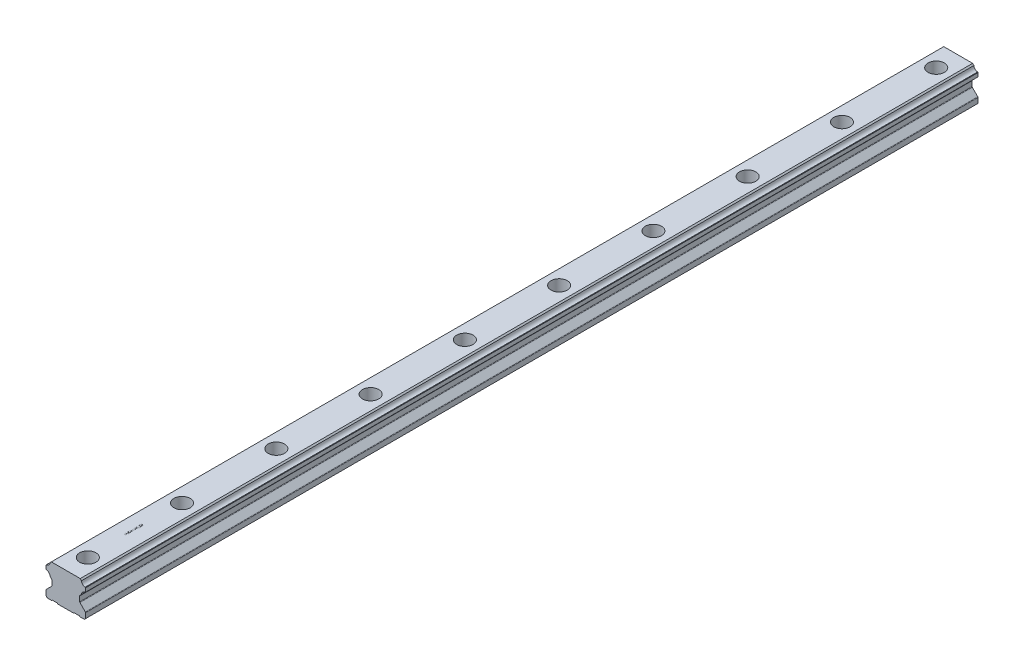
from build123d import *

# Parameters (mm, degrees)
EXTRUDE_1_DEPTH               = 1420
HOLE_WIZARD_M16_1_D           = 18
HOLE_WIZARD_M16_1_CBORE_D     = 26
HOLE_WIZARD_M16_1_CBORE_DEPTH = 22
PATTERN_LINEAR_1_COUNT        = 10
PATTERN_LINEAR_1_PITCH        = 150
SKETCH_6_W                    = 3.5
SKETCH_6_H                    = 0.314102564
CUT_EXTRUDE_1_DEPTH           = 0.1


with BuildPart() as part:
    # 草图1 → 凸台-拉伸1 (new body)
    with BuildSketch(Plane.XY):
        with BuildLine():
            Line((-23.000030581, 53), (-24.991126345, 51.008904236))
            ThreePointArc((-24.991126345, 51.008904236), (-26.747381462, 46.881368462), (-30.874917236, 45.125113345))
            Line((-30.874917236, 45.125113345), (-31.5, 44.500030581))
            Line((-31.5, 44.500030581), (-31.5, 38.499998))
            Line((-31.5, 38.499998), (-30.87588311, 37.87588111))
            ThreePointArc((-30.87588311, 37.87588111), (-26.747381462, 36.119607538), (-24.99110789, 31.99110589))
            Line((-24.99110789, 31.99110589), (-22.539339828, 29.539337828))
            ThreePointArc((-22.539339828, 29.539337828), (-22.214180701, 29.052702805), (-22.1, 28.478677656))
            Line((-22.1, 28.478677656), (-22.1, 20.6627417))
            ThreePointArc((-22.1, 20.6627417), (-22.214180701, 20.088716551), (-22.539339828, 19.602081528))
            Line((-22.539339828, 19.602081528), (-31.060660172, 11.080761184))
            ThreePointArc((-31.060660172, 11.080761184), (-31.385819299, 10.594126161), (-31.5, 10.020101013))
            Line((-31.5, 10.020101013), (-31.5, 2))
            Line((-31.5, 2), (-29.5, 0))
            Line((-29.5, 0), (-22.5, 0))
            Line((-22.5, 0), (-21.500011002, 1))
            Line((-21.500011002, 1), (-13.500001416, 1))
            Line((-13.500001416, 1), (-12.5, 0))
            Line((-12.5, 0), (12.5, 0))
            Line((12.5, 0), (13.500001416, 1))
            Line((13.500001416, 1), (21.500011002, 1))
            Line((21.500011002, 1), (22.5, 0))
            Line((22.5, 0), (29.5, 0))
            Line((29.5, 0), (31.5, 2))
            Line((31.5, 2), (31.5, 10.020101013))
            ThreePointArc((31.5, 10.020101013), (31.385819299, 10.594126161), (31.060660172, 11.080761184))
            Line((31.060660172, 11.080761184), (22.539339828, 19.602081528))
            ThreePointArc((22.539339828, 19.602081528), (22.214180701, 20.088716551), (22.1, 20.6627417))
            Line((22.1, 20.6627417), (22.1, 28.478677656))
            ThreePointArc((22.1, 28.478677656), (22.214180701, 29.052702805), (22.539339828, 29.539337828))
            Line((22.539339828, 29.539337828), (24.99110789, 31.99110589))
            ThreePointArc((24.99110789, 31.99110589), (26.747381462, 36.119607538), (30.87588311, 37.87588111))
            Line((30.87588311, 37.87588111), (31.5, 38.499998))
            Line((31.5, 38.499998), (31.5, 44.500030581))
            Line((31.5, 44.500030581), (30.874917236, 45.125113345))
            ThreePointArc((30.874917236, 45.125113345), (26.747381462, 46.881368462), (24.991126345, 51.008904236))
            Line((24.991126345, 51.008904236), (23.000030581, 53))
            Line((23.000030581, 53), (-23.000030581, 53))
        make_face()
    extrude(amount=-EXTRUDE_1_DEPTH)

    # M16 六角凹头螺钉的柱形沉头孔1 (through all)
    with Locations(Plane(origin=(-6.823926913, 53, -130.778829662), x_dir=(-1, 0, 0), z_dir=(0, 1, 0))):
        with Locations((-6.823926913, 95.778829662)):
            hole_wizard_m16_1 = CounterBoreHole(HOLE_WIZARD_M16_1_D / 2, HOLE_WIZARD_M16_1_CBORE_D / 2, HOLE_WIZARD_M16_1_CBORE_DEPTH)

    # 阵列(线性)1: M16 六角凹头螺钉的柱形沉头孔1 ×10
    with Locations(*[(0, 0, -i * PATTERN_LINEAR_1_PITCH) for i in range(1, PATTERN_LINEAR_1_COUNT)]):
        add(hole_wizard_m16_1, mode=Mode.SUBTRACT)

    # 草图6 → 切除-拉伸1 (cut)
    # profile 1 of 9: a face of its own
    with BuildSketch(Plane(origin=(0, 53, 0), x_dir=(1, 0, 0), z_dir=(0, 1, 0))):
        Polygon((-3.5, 96.403846154), (-3.5, 96.717948718), (-2.064102564, 96.717948718), (-2.064102564, 98.512820513), (-3.5, 98.512820513), (-3.5, 98.826923077), (0, 98.826923077), (0, 98.512820513), (-1.705128205, 98.512820513), (-1.705128205, 96.717948718), (0, 96.717948718), (0, 96.403846154), align=None)
    # profile 2 of 9: a face of its own
    with BuildSketch(Plane(origin=(0, 53, 0), x_dir=(1, 0, 0), z_dir=(0, 1, 0))):
        with Locations((-1.75, 99.881410256)):
            Rectangle(SKETCH_6_W, SKETCH_6_H)
    # profile 3 of 9: a face of its own
    with BuildSketch(Plane(origin=(0, 53, 0), x_dir=(1, 0, 0), z_dir=(0, 1, 0))):
        Polygon((-3.5, 100.576923077), (-3.5, 100.901542468), (-0.933193109, 101.586538462), (-3.5, 102.605268429), (-3.5, 102.650841346), (-0.950721154, 103.650641026), (-3.5, 104.339142628), (-3.5, 104.66025641), (0, 103.716546474), (0, 103.671674679), (-2.676883013, 102.618589744), (0, 101.552884615), (0, 101.508012821), align=None)
    # profile 4 of 9: a face of its own
    with BuildSketch(Plane(origin=(0, 53, 0), x_dir=(1, 0, 0), z_dir=(0, 1, 0))):
        with Locations((-1.75, 105.625)):
            Rectangle(SKETCH_6_W, SKETCH_6_H)
    # profile 5 of 9: a face of its own
    with BuildSketch(Plane(origin=(0, 53, 0), x_dir=(1, 0, 0), z_dir=(0, 1, 0))):
        Polygon((0, 106.544871795), (-3.5, 106.544871795), (-3.5, 106.610777244), (-0.745292468, 108.923076923), (-3.5, 108.923076923), (-3.5, 109.237179487), (0, 109.237179487), (0, 109.165665064), (-2.748397436, 106.858974359), (0, 106.858974359), align=None)
    # profile 6 of 9: a face of its own
    with BuildSketch(Plane(origin=(0, 53, 0), x_dir=(1, 0, 0), z_dir=(0, 1, 0))):
        Polygon((-3.5, 111.480769231), (-3.5, 111.794871795), (-2.064102564, 111.794871795), (-2.064102564, 113.58974359), (-3.5, 113.58974359), (-3.5, 113.903846154), (0, 113.903846154), (0, 113.58974359), (-1.705128205, 113.58974359), (-1.705128205, 111.794871795), (0, 111.794871795), (0, 111.480769231), align=None)
    # profile 7 of 9: a face of its own
    with BuildSketch(Plane(origin=(0, 53, 0), x_dir=(1, 0, 0), z_dir=(0, 1, 0))):
        with BuildLine():
            Line((-2.902644231, 118.076923077), (-2.647435897, 117.807692308))
            add(Edge.make_bspline(
                [(-2.647435897, 117.807692308), (-2.69328212, 117.758983227), (-2.783881335, 117.662726562), (-2.901244074, 117.50552662), (-3.002777003, 117.342170767), (-3.084772592, 117.172394867), (-3.149094254, 117.000650867), (-3.195850217, 116.829891913), (-3.225460377, 116.661223615), (-3.229016796, 116.549059313), (-3.230769231, 116.493790064)],
                knots=[0, 0, 0, 0, 1.089067066, 2.152164705, 3.18986567, 4.218445106, 5.218487318, 6.173592265, 7.100032889, 8, 8, 8, 8], degree=3))
            add(Edge.make_bspline(
                [(-3.230769231, 116.493790064), (-3.230355625, 116.459875364), (-3.229529486, 116.392133924), (-3.218985271, 116.29151198), (-3.203820407, 116.191945342), (-3.181878529, 116.093621968), (-3.15406947, 115.99635068), (-3.119284004, 115.900469793), (-3.078728771, 115.805800421), (-3.031866252, 115.713234402), (-2.980386575, 115.623493669), (-2.923337414, 115.538737672), (-2.862550889, 115.458421211), (-2.796491613, 115.384072004), (-2.725807311, 115.31519549), (-2.651770944, 115.250524789), (-2.572926872, 115.191265211), (-2.489599321, 115.138479571), (-2.403726867, 115.090811977), (-2.316037795, 115.049619777), (-2.227346143, 115.013809823), (-2.136984078, 114.986535862), (-2.045883197, 114.963434988), (-1.953566086, 114.947353752), (-1.859791669, 114.938257435), (-1.796993971, 114.936686944), (-1.765424679, 114.935897436)],
                knots=[0, 0, 0, 0, 1.028150113, 2.053633673, 3.06513288, 4.081487945, 5.106702018, 6.131327874, 7.172780699, 8.228344599, 9.276313556, 10.308389736, 11.324843658, 12.329040066, 13.321460474, 14.316307835, 15.308626991, 16.309440696, 17.305625405, 18.28535951, 19.246194545, 20.203493668, 21.145557131, 22.095268976, 23.042464743, 24, 24, 24, 24], degree=3))
            add(Edge.make_bspline(
                [(-1.765424679, 114.935897436), (-1.733154018, 114.936653631), (-1.668700816, 114.938163957), (-1.572504414, 114.947817154), (-1.477747832, 114.965772364), (-1.384282029, 114.989584114), (-1.291920993, 115.019856789), (-1.20076111, 115.057049303), (-1.110811241, 115.101355435), (-1.022964324, 115.152526704), (-0.937464192, 115.209036172), (-0.856251713, 115.271187356), (-0.780271995, 115.339084893), (-0.708415252, 115.411483836), (-0.641134974, 115.489043832), (-0.579242122, 115.572517364), (-0.521779643, 115.660735956), (-0.469378807, 115.753738745), (-0.42257144, 115.850542725), (-0.38094723, 115.949799156), (-0.346667976, 116.051827058), (-0.31872985, 116.156089724), (-0.295829559, 116.262463002), (-0.281097077, 116.371486803), (-0.270406246, 116.482359512), (-0.269624576, 116.557098144), (-0.269230769, 116.594751603)],
                knots=[0, 0, 0, 0, 0.935915162, 1.869274651, 2.799799983, 3.730201895, 4.664668062, 5.616159355, 6.583070886, 7.570012957, 8.562524459, 9.553461134, 10.53281078, 11.515274572, 12.509912756, 13.507571325, 14.526460018, 15.561318395, 16.601025881, 17.643204557, 18.680545676, 19.719612342, 20.772381578, 21.833430283, 22.908478249, 24, 24, 24, 24], degree=3))
            add(Edge.make_bspline(
                [(-0.269230769, 116.594751603), (-0.270178952, 116.640130135), (-0.272040863, 116.729238255), (-0.286546735, 116.860222075), (-0.309173205, 116.986034693), (-0.342412256, 117.106266531), (-0.384484705, 117.221353926), (-0.436513285, 117.330872414), (-0.497950569, 117.435124408), (-0.567552463, 117.533658668), (-0.645100929, 117.624132689), (-0.728035637, 117.706474768), (-0.817431068, 117.77785339), (-0.911954918, 117.840400707), (-1.012511326, 117.892097951), (-1.118540888, 117.934543829), (-1.230109213, 117.967076285), (-1.307200733, 117.980431374), (-1.346153846, 117.987179487)],
                knots=[0, 0, 0, 0, 1.130199668, 2.219330667, 3.279027493, 4.311506524, 5.322739849, 6.327972234, 7.327472899, 8.33386792, 9.329086447, 10.29244429, 11.240784345, 12.174119183, 13.111530729, 14.052100829, 15.015757696, 16, 16, 16, 16], degree=3))
            Line((-1.346153846, 117.987179487), (-1.346153846, 116.820512821))
            Line((-1.346153846, 116.820512821), (-1.705128205, 116.820512821))
            Line((-1.705128205, 116.820512821), (-1.705128205, 118.301282051))
            add(Edge.make_bspline(
                [(-1.705128205, 118.301282051), (-1.638220716, 118.299576203), (-1.507270675, 118.296237549), (-1.316300404, 118.272818634), (-1.13592871, 118.235002122), (-0.965965639, 118.18334181), (-0.806652046, 118.116466529), (-0.65782618, 118.035094001), (-0.520449499, 117.93792188), (-0.393400495, 117.828411438), (-0.280071283, 117.705511481), (-0.180465345, 117.572542861), (-0.09656273, 117.429285892), (-0.028302067, 117.275876085), (0.024971927, 117.112815651), (0.062743504, 116.939727272), (0.085373467, 116.756845671), (0.088264847, 116.631508994), (0.08974359, 116.567407853)],
                knots=[0, 0, 0, 0, 1.140356446, 2.231883559, 3.274166699, 4.278491846, 5.25512956, 6.21435461, 7.1637429, 8.11826594, 9.068280886, 10.0076534, 10.945064095, 11.891975133, 12.864533718, 13.863980011, 14.907571808, 16, 16, 16, 16], degree=3))
            add(Edge.make_bspline(
                [(0.08974359, 116.567407853), (0.089174469, 116.527897717), (0.088051978, 116.449970996), (0.080074631, 116.334880068), (0.067794054, 116.222962448), (0.049248931, 116.114234439), (0.026534277, 116.008296097), (-0.002552442, 115.905676512), (-0.036221141, 115.80598477), (-0.074516815, 115.709066784), (-0.118888472, 115.615802237), (-0.168198111, 115.52577572), (-0.222191472, 115.438489595), (-0.281802318, 115.35453843), (-0.346584778, 115.273484808), (-0.416668697, 115.195851364), (-0.491839816, 115.121203486), (-0.545218826, 115.074443023), (-0.572115385, 115.05088141)],
                knots=[0, 0, 0, 0, 1.107784379, 2.184907829, 3.233506516, 4.263428166, 5.276301166, 6.270063455, 7.25232949, 8.225834625, 9.190232166, 10.146266622, 11.1027726, 12.066435141, 13.031522626, 14.010570082, 14.99756817, 16, 16, 16, 16], degree=3))
            add(Edge.make_bspline(
                [(-0.572115385, 115.05088141), (-0.614786038, 115.016695478), (-0.699419055, 114.948891066), (-0.835018999, 114.861612909), (-0.975420859, 114.787211506), (-1.121015488, 114.726843684), (-1.271666701, 114.679705598), (-1.427181992, 114.645899345), (-1.587761622, 114.626092056), (-1.696426887, 114.623238518), (-1.751402244, 114.621794872)],
                knots=[0, 0, 0, 0, 1.023165419, 2.029347347, 3.013907458, 3.994755782, 4.975994455, 5.96558838, 6.970761222, 8, 8, 8, 8], degree=3))
            add(Edge.make_bspline(
                [(-1.751402244, 114.621794872), (-1.792568496, 114.62232711), (-1.874377804, 114.623384821), (-1.99583511, 114.636210339), (-2.115135808, 114.654611751), (-2.232182344, 114.681658827), (-2.347053012, 114.715755013), (-2.45980069, 114.758308794), (-2.570493643, 114.807852572), (-2.67836343, 114.865442289), (-2.782003044, 114.929511026), (-2.880905313, 114.999118682), (-2.973467332, 115.074802367), (-3.059903521, 115.156782462), (-3.141494975, 115.243406392), (-3.216537375, 115.336492693), (-3.286205011, 115.434631029), (-3.349159221, 115.538582169), (-3.405727075, 115.6467058), (-3.455315154, 115.758766886), (-3.496298775, 115.874724704), (-3.531072472, 115.993712261), (-3.556787635, 116.11662974), (-3.575436374, 116.242585283), (-3.588196976, 116.372235393), (-3.589223231, 116.459871423), (-3.58974359, 116.504306891)],
                knots=[0, 0, 0, 0, 1.00895651, 2.005089799, 2.991467152, 3.967318338, 4.948153826, 5.927364234, 6.919980553, 7.91976625, 8.923240147, 9.905815003, 10.88314567, 11.851989312, 12.825009789, 13.798721852, 14.781296708, 15.773896486, 16.776076962, 17.771600213, 18.775744723, 19.78957137, 20.808953803, 21.851964491, 22.910847925, 24, 24, 24, 24], degree=3))
            add(Edge.make_bspline(
                [(-3.58974359, 116.504306891), (-3.589164098, 116.540545135), (-3.588015034, 116.612401313), (-3.580050386, 116.719327046), (-3.567426505, 116.82460006), (-3.550199718, 116.92837645), (-3.526736028, 117.030302816), (-3.498657743, 117.130669522), (-3.46596592, 117.229622058), (-3.426977074, 117.326850307), (-3.382723449, 117.423008023), (-3.332910027, 117.518629864), (-3.276685022, 117.61338911), (-3.213881487, 117.707450091), (-3.145578069, 117.801405949), (-3.069821245, 117.893770591), (-2.989598489, 117.986773536), (-2.931916305, 118.04657535), (-2.902644231, 118.076923077)],
                knots=[0, 0, 0, 0, 0.985871117, 1.954866573, 2.915460327, 3.869826059, 4.81536089, 5.759505086, 6.70452669, 7.649098992, 8.607881297, 9.583363685, 10.581137262, 11.603961102, 12.659522466, 13.73993555, 14.853081303, 16, 16, 16, 16], degree=3))
        make_face()
    # profile 8 of 9: a face of its own
    with BuildSketch(Plane(origin=(0, 53, 0), x_dir=(1, 0, 0), z_dir=(0, 1, 0))):
        with BuildLine():
            Line((-3.58974359, 120.320512821), (-3.399739583, 120.56239984))
            Line((-3.399739583, 120.56239984), (-1.985576923, 119.637620192))
            add(Edge.make_bspline(
                [(-1.985576923, 119.637620192), (-1.995390784, 119.699190469), (-2.014533829, 119.819290256), (-2.017691774, 119.940856155), (-2.019230769, 120.00010016)],
                knots=[0, 0, 0, 0, 1.025318673, 2, 2, 2, 2], degree=3))
            add(Edge.make_bspline(
                [(-2.019230769, 120.00010016), (-2.018274658, 120.035672657), (-2.01639258, 120.105696057), (-2.001908729, 120.208502858), (-1.979083619, 120.307291798), (-1.945811357, 120.401653396), (-1.903309025, 120.49192643), (-1.852370067, 120.578628629), (-1.790364723, 120.660131396), (-1.721098473, 120.737479659), (-1.644386305, 120.807717612), (-1.56296755, 120.869854406), (-1.476848647, 120.922334119), (-1.386048964, 120.964144997), (-1.291279266, 120.997559294), (-1.192169945, 121.021346206), (-1.088553728, 121.03556638), (-1.018073453, 121.037486285), (-0.982271635, 121.038461538)],
                knots=[0, 0, 0, 0, 1.043709831, 2.054511743, 3.041122595, 4.01515914, 4.98481438, 5.965901842, 6.960491961, 7.985277438, 9.0096037, 10.00832444, 10.987059228, 11.962929573, 12.936966118, 13.931840027, 14.949438142, 16, 16, 16, 16], degree=3))
            add(Edge.make_bspline(
                [(-0.982271635, 121.038461538), (-0.933290098, 121.037041892), (-0.836906025, 121.034248364), (-0.696555504, 121.006295162), (-0.562926162, 120.96318285), (-0.438330275, 120.900574384), (-0.321904881, 120.824281584), (-0.219084187, 120.730100517), (-0.127384518, 120.622703924), (-0.050736149, 120.501204069), (0.011869141, 120.370464648), (0.056833789, 120.23311171), (0.084517414, 120.090484811), (0.087987996, 119.99368017), (0.08974359, 119.944711538)],
                knots=[0, 0, 0, 0, 1.031403119, 2.029557249, 3.004870281, 3.983165322, 4.960181699, 5.929903783, 6.912123683, 7.928973898, 8.949315281, 9.960468141, 10.968302741, 12, 12, 12, 12], degree=3))
            add(Edge.make_bspline(
                [(0.08974359, 119.944711538), (0.088219727, 119.897612856), (0.085201221, 119.804318611), (0.058171766, 119.667114809), (0.014673233, 119.535045219), (-0.046510348, 119.409805139), (-0.122487554, 119.293596564), (-0.213316504, 119.188799795), (-0.319123382, 119.098223467), (-0.437593599, 119.022166614), (-0.564720568, 118.961587346), (-0.69750636, 118.916582541), (-0.835393511, 118.890155545), (-0.928876381, 118.886471136), (-0.975961538, 118.884615385)],
                knots=[0, 0, 0, 0, 1.012172929, 2.004937354, 2.995255351, 3.995689452, 4.993936421, 5.973737378, 6.968231049, 7.979117505, 8.993136101, 9.989812463, 10.987515067, 12, 12, 12, 12], degree=3))
            add(Edge.make_bspline(
                [(-0.975961538, 118.884615385), (-1.012006122, 118.88579683), (-1.085602274, 118.888209115), (-1.197066302, 118.905052505), (-1.311117383, 118.9321173), (-1.407871577, 118.962427546), (-1.487133099, 118.994453156), (-1.55103659, 119.021105696), (-1.616797663, 119.054279692), (-1.686671299, 119.089653073), (-1.758856731, 119.130409942), (-1.834560401, 119.174725591), (-1.912578329, 119.223825242), (-1.965522524, 119.258245405), (-1.992588141, 119.275841346)],
                knots=[0, 0, 0, 0, 1.173818275, 2.396712641, 3.66331629, 4.989737886, 5.693666774, 6.447286557, 7.243889047, 8.091586357, 8.998013824, 9.943181721, 10.948533338, 12, 12, 12, 12], degree=3))
            Line((-1.992588141, 119.275841346), (-3.58974359, 120.320512821))
        make_face()
        with BuildLine():
            add(Edge.make_bspline(
                [(-1.66025641, 119.934194712), (-1.659485878, 119.907529869), (-1.657980805, 119.855445686), (-1.649050486, 119.779074605), (-1.632796287, 119.70655985), (-1.610258424, 119.637880373), (-1.582471876, 119.572612494), (-1.546819296, 119.51204964), (-1.505292177, 119.454945565), (-1.457965644, 119.402212643), (-1.406184395, 119.354390165), (-1.350713106, 119.313209767), (-1.292899361, 119.277687177), (-1.232257298, 119.248805409), (-1.168810831, 119.226315319), (-1.102851573, 119.210047072), (-1.033937269, 119.20099332), (-0.987204766, 119.199487089), (-0.963341346, 119.198717949)],
                knots=[0, 0, 0, 0, 1.129656352, 2.206547016, 3.251334079, 4.271920891, 5.265058649, 6.249872215, 7.241923875, 8.251504132, 9.246416584, 10.222533834, 11.173322129, 12.116503788, 13.062124155, 14.020151864, 14.989013135, 16, 16, 16, 16], degree=3))
            add(Edge.make_bspline(
                [(-0.963341346, 119.198717949), (-0.939695498, 119.199366491), (-0.893098454, 119.200644523), (-0.824698752, 119.211525681), (-0.759026586, 119.228918076), (-0.696328765, 119.254042564), (-0.635401654, 119.284573821), (-0.578147176, 119.323763041), (-0.522710735, 119.368740878), (-0.471668092, 119.421256612), (-0.424282184, 119.478046909), (-0.382692201, 119.538593419), (-0.347523558, 119.601984515), (-0.318382451, 119.668037624), (-0.29693044, 119.737569246), (-0.280507759, 119.809450365), (-0.271529256, 119.884658287), (-0.270006987, 119.935575387), (-0.269230769, 119.961538462)],
                knots=[0, 0, 0, 0, 0.989367052, 1.949669134, 2.891858276, 3.827522767, 4.772653562, 5.738670152, 6.725809442, 7.756636004, 8.798867547, 9.819240912, 10.826537776, 11.829883227, 12.835515726, 13.868058748, 14.912904531, 16, 16, 16, 16], degree=3))
            add(Edge.make_bspline(
                [(-0.269230769, 119.961538462), (-0.270007048, 119.987501493), (-0.271529435, 120.03841851), (-0.280507079, 120.113627038), (-0.296932933, 120.18550592), (-0.318373419, 120.255045664), (-0.34755727, 120.321068653), (-0.382472115, 120.384404337), (-0.424537191, 120.44437821), (-0.471586732, 120.501205465), (-0.523002402, 120.553502952), (-0.577647666, 120.59953862), (-0.635859778, 120.637503483), (-0.696089201, 120.669245283), (-0.759064035, 120.69409158), (-0.824688531, 120.711569601), (-0.893101121, 120.72242761), (-0.939696396, 120.72370882), (-0.963341346, 120.724358974)],
                knots=[0, 0, 0, 0, 1.087281468, 2.132306021, 3.165025708, 4.170830268, 5.174347389, 6.181816599, 7.194310624, 8.23672049, 9.267723423, 10.261267456, 11.222032883, 12.171822355, 13.107646935, 14.049997283, 15.01046367, 16, 16, 16, 16], degree=3))
            add(Edge.make_bspline(
                [(-0.963341346, 120.724358974), (-0.987235897, 120.723808681), (-1.03413313, 120.722728635), (-1.102820746, 120.710512686), (-1.169145961, 120.693570315), (-1.232691878, 120.667987272), (-1.293207925, 120.634750775), (-1.350999064, 120.594267186), (-1.406511223, 120.547435329), (-1.458066973, 120.493335008), (-1.505240868, 120.434455343), (-1.546762184, 120.371801038), (-1.582204948, 120.306514555), (-1.610172096, 120.237676241), (-1.632702747, 120.166212308), (-1.648992533, 120.091629288), (-1.657957526, 120.013874135), (-1.659480355, 119.961092814), (-1.66025641, 119.934194712)],
                knots=[0, 0, 0, 0, 0.978259475, 1.920005202, 2.851759169, 3.7803069, 4.719124913, 5.675758531, 6.668034766, 7.691045932, 8.733780038, 9.756656648, 10.768121246, 11.773215211, 12.79725739, 13.836288844, 14.897342417, 16, 16, 16, 16], degree=3))
        make_face(mode=Mode.SUBTRACT)
    # profile 9 of 9: a face of its own
    with BuildSketch(Plane(origin=(0, 53, 0), x_dir=(1, 0, 0), z_dir=(0, 1, 0))):
        with BuildLine():
            Line((-3.5, 123.596153846), (-3.141025641, 123.596153846))
            Line((-3.141025641, 123.596153846), (-3.141025641, 122.405649038))
            Line((-3.141025641, 122.405649038), (-2.220452724, 122.217047276))
            add(Edge.make_bspline(
                [(-2.220452724, 122.217047276), (-2.230682996, 122.25410315), (-2.25050253, 122.325893046), (-2.2725083, 122.431852907), (-2.285773744, 122.53244511), (-2.287585055, 122.597720481), (-2.288461538, 122.629306891)],
                knots=[0, 0, 0, 0, 1.100273476, 2.13160584, 3.095893838, 4, 4, 4, 4], degree=3))
            add(Edge.make_bspline(
                [(-2.288461538, 122.629306891), (-2.28764354, 122.668397805), (-2.28603515, 122.745260309), (-2.269673986, 122.857544614), (-2.245976174, 122.96527195), (-2.209465207, 123.066851732), (-2.164878805, 123.163891055), (-2.108721258, 123.254723386), (-2.04315746, 123.34062356), (-1.968525078, 123.420997879), (-1.885534459, 123.493570878), (-1.795933934, 123.556634421), (-1.701678739, 123.611677196), (-1.600559725, 123.654605621), (-1.494484031, 123.689639403), (-1.382227183, 123.712740767), (-1.264785773, 123.728171477), (-1.18448027, 123.729891917), (-1.143529647, 123.730769231)],
                knots=[0, 0, 0, 0, 1.052805225, 2.070078116, 3.052532748, 4.020689046, 4.973125432, 5.925915817, 6.89216474, 7.881560752, 8.877013184, 9.857446635, 10.830895175, 11.812622661, 12.812548702, 13.836681939, 14.896847428, 16, 16, 16, 16], degree=3))
            add(Edge.make_bspline(
                [(-1.143529647, 123.730769231), (-1.115007605, 123.730103556), (-1.058348972, 123.728781204), (-0.974202158, 123.7220714), (-0.891849045, 123.709103007), (-0.811440613, 123.69190289), (-0.732901554, 123.668941583), (-0.65579213, 123.642084161), (-0.580956685, 123.608702163), (-0.508064701, 123.571694489), (-0.437950402, 123.530715464), (-0.372294905, 123.484635462), (-0.309599937, 123.436755685), (-0.251727444, 123.384438189), (-0.198452948, 123.328277796), (-0.149513072, 123.268586987), (-0.104029493, 123.205907167), (-0.063861909, 123.139251137), (-0.026898788, 123.070108867), (0.003424705, 122.997480593), (0.030535245, 122.923019908), (0.05214477, 122.845655028), (0.069077325, 122.765561217), (0.080577925, 122.682606441), (0.088954363, 122.597225771), (0.08947872, 122.539350758), (0.08974359, 122.510116186)],
                knots=[0, 0, 0, 0, 1.056393913, 2.098511576, 3.122979385, 4.141471433, 5.141222888, 6.151259816, 7.162667642, 8.172852865, 9.177685681, 10.166741883, 11.141342384, 12.097242845, 13.052202613, 14.005160326, 14.953864445, 15.917140761, 16.884916217, 17.854238259, 18.828761908, 19.81781811, 20.826036654, 21.857789401, 22.917898972, 24, 24, 24, 24], degree=3))
            add(Edge.make_bspline(
                [(0.08974359, 122.510116186), (0.089050894, 122.475242894), (0.087688097, 122.406633813), (0.073496095, 122.30610057), (0.053035464, 122.209432256), (0.022721931, 122.117043177), (-0.016971483, 122.029318648), (-0.064133263, 121.945002475), (-0.12027864, 121.865139718), (-0.184894072, 121.790276377), (-0.255892818, 121.721460371), (-0.332202561, 121.65905751), (-0.413920487, 121.604193873), (-0.500780871, 121.556670445), (-0.592629648, 121.516184815), (-0.689749822, 121.484366409), (-0.791650601, 121.45868899), (-0.861804004, 121.447825441), (-0.897435897, 121.442307692)],
                knots=[0, 0, 0, 0, 1.046872515, 2.059598001, 3.044168548, 4.012104806, 4.973680974, 5.932408326, 6.910122221, 7.900780896, 8.89867654, 9.876692837, 10.858029398, 11.85084981, 12.847361615, 13.868568023, 14.917415949, 16, 16, 16, 16], degree=3))
            Line((-0.897435897, 121.442307692), (-0.897435897, 121.756410256))
            add(Edge.make_bspline(
                [(-0.897435897, 121.756410256), (-0.86405597, 121.764133979), (-0.799897896, 121.778979402), (-0.709812799, 121.811649494), (-0.62950762, 121.851206459), (-0.558491359, 121.899340396), (-0.495464081, 121.955133792), (-0.43989307, 122.019990731), (-0.389697273, 122.092289811), (-0.347784769, 122.17267219), (-0.312479137, 122.257640252), (-0.287283878, 122.346063351), (-0.272032646, 122.436668904), (-0.270168243, 122.497671524), (-0.269230769, 122.528345353)],
                knots=[0, 0, 0, 0, 1.13623081, 2.183898708, 3.172478118, 4.09966615, 5.022692284, 5.957376522, 6.927682873, 7.937366477, 8.960015386, 9.976409503, 10.982481913, 12, 12, 12, 12], degree=3))
            add(Edge.make_bspline(
                [(-0.269230769, 122.528345353), (-0.270058415, 122.558301256), (-0.271688055, 122.617284674), (-0.284028564, 122.704132513), (-0.303533592, 122.787735767), (-0.33085902, 122.868242843), (-0.367008958, 122.945258145), (-0.411417074, 123.018672781), (-0.462975425, 123.089532607), (-0.521904738, 123.1559727), (-0.586881759, 123.216808942), (-0.656357238, 123.270565902), (-0.730474586, 123.315342595), (-0.807947606, 123.353076763), (-0.889626199, 123.381730046), (-0.975127364, 123.402171031), (-1.064662347, 123.414174089), (-1.125731657, 123.415825269), (-1.156850962, 123.416666667)],
                knots=[0, 0, 0, 0, 1.027268864, 2.022700798, 3.002744649, 3.968653148, 4.933396556, 5.915045722, 6.907600446, 7.935526002, 8.956456544, 9.95700807, 10.942805781, 11.92166854, 12.907987664, 13.905483474, 14.932689774, 16, 16, 16, 16], degree=3))
            add(Edge.make_bspline(
                [(-1.156850962, 123.416666667), (-1.184930032, 123.416028195), (-1.239659043, 123.414783746), (-1.320009695, 123.404010642), (-1.396158478, 123.386014341), (-1.468436727, 123.360391264), (-1.536613353, 123.328412845), (-1.600538112, 123.288262971), (-1.660812066, 123.241651258), (-1.715884112, 123.187233139), (-1.766793088, 123.12803749), (-1.810034281, 123.062543866), (-1.846807397, 122.992500701), (-1.876936465, 122.917778197), (-1.900936575, 122.838284311), (-1.917523378, 122.753976228), (-1.92744867, 122.664834733), (-1.928795087, 122.603859089), (-1.929487179, 122.572516026)],
                knots=[0, 0, 0, 0, 1.045723156, 2.038222538, 3.013889863, 3.95567481, 4.890389958, 5.81331128, 6.76251276, 7.723027653, 8.692928204, 9.666105983, 10.639751036, 11.635719707, 12.66315958, 13.728667616, 14.832476222, 16, 16, 16, 16], degree=3))
            add(Edge.make_bspline(
                [(-1.929487179, 122.572516026), (-1.928906588, 122.545387097), (-1.927707815, 122.489372742), (-1.918881318, 122.403449915), (-1.904642024, 122.313158192), (-1.885055776, 122.218843696), (-1.859424699, 122.120223188), (-1.828710199, 122.017504787), (-1.7919882, 121.910472521), (-1.764255986, 121.838354796), (-1.75, 121.801282051)],
                knots=[0, 0, 0, 0, 0.817624296, 1.688186739, 2.600797293, 3.572016777, 4.590301741, 5.671205678, 6.80286297, 8, 8, 8, 8], degree=3))
            Line((-1.75, 121.801282051), (-3.5, 122.16025641))
            Line((-3.5, 122.16025641), (-3.5, 123.596153846))
        make_face()
    extrude(amount=-CUT_EXTRUDE_1_DEPTH, mode=Mode.SUBTRACT)


solid = part.part
